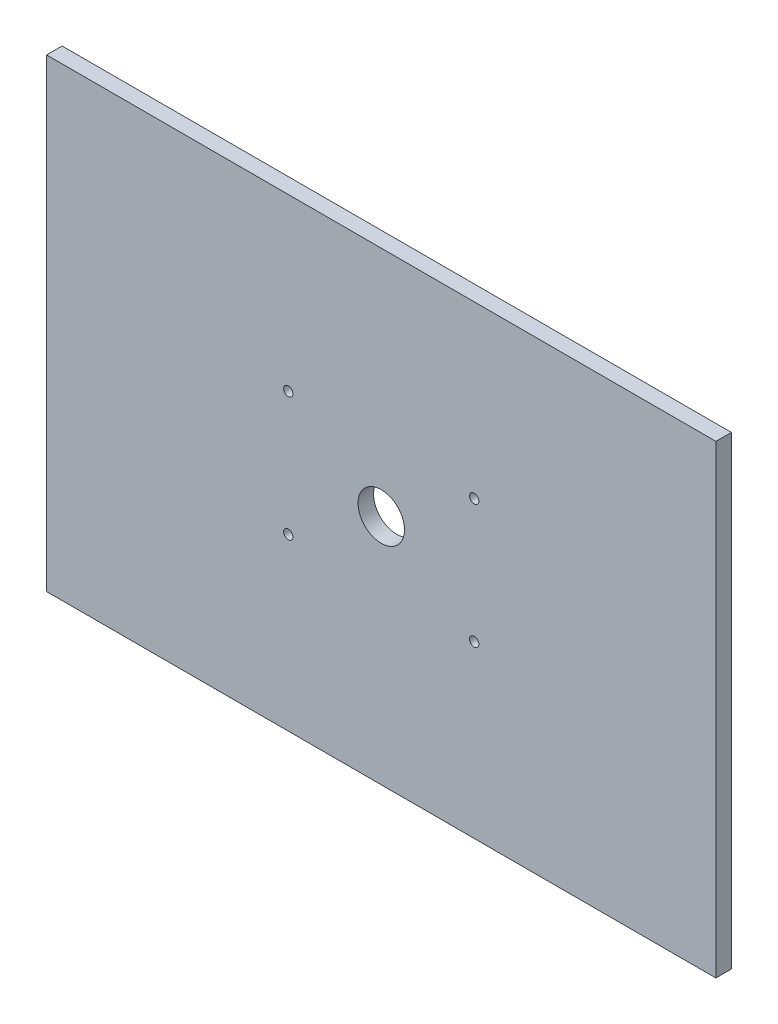
from build123d import *

# Parameters (mm, degrees)
SKETCH1_W           = 274.32
SKETCH1_H           = 190.5
BOSS_EXTRUDE1_DEPTH = 6.35
SKETCH2_R           = 9.525
CUT_EXTRUDE1_DEPTH  = 168.109995512
SKETCH3_R           = 1.905
CUT_EXTRUDE2_DEPTH  = 168.109995512


with BuildPart() as part:
    # Sketch1 → Boss-Extrude1 (new body)
    with BuildSketch(Plane.XY):
        Rectangle(SKETCH1_W, SKETCH1_H)
    extrude(amount=BOSS_EXTRUDE1_DEPTH)

    # Sketch2 → Cut-Extrude1 (cut, through all)
    with BuildSketch(Plane.XY.offset(6.35)):
        Circle(SKETCH2_R)
    extrude(amount=-CUT_EXTRUDE1_DEPTH, mode=Mode.SUBTRACT)

    # Sketch3 → Cut-Extrude2 (cut, through all)
    with BuildSketch(Plane.XY.offset(6.35)):
        with Locations((-38.1, 25.4)):
            Circle(SKETCH3_R)
        with Locations((-38.1, -25.4)):
            Circle(SKETCH3_R)
        with Locations((38.1, -25.4)):
            Circle(SKETCH3_R)
        with Locations((38.1, 25.4)):
            Circle(SKETCH3_R)
    extrude(amount=-CUT_EXTRUDE2_DEPTH, mode=Mode.SUBTRACT)


solid = part.part
